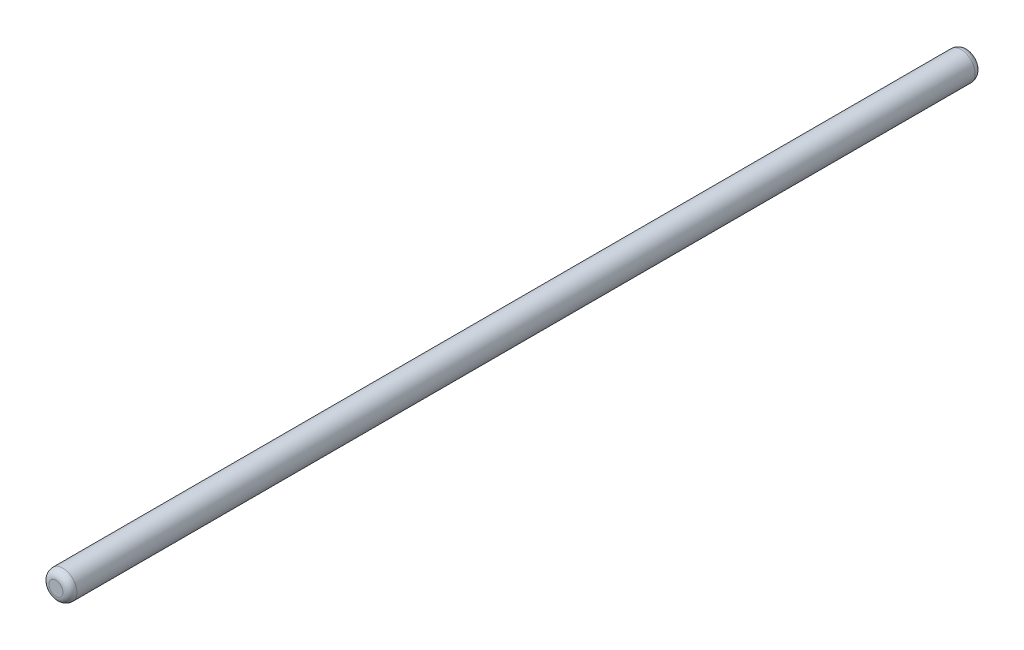
from build123d import *

# Parameters (mm, degrees)
SKETCH1_R           = 4
BOSS_EXTRUDE1_DEPTH = 260.525021331
FILLET1_R           = 2


with BuildPart() as part:
    # Sketch1 → Boss-Extrude1 (new body)
    with BuildSketch(Plane.XY):
        Circle(SKETCH1_R)
    extrude(amount=BOSS_EXTRUDE1_DEPTH)

    # Fillet1
    fillet1_edges = [part.edges().sort_by_distance(p)[0] for p in [
        (-4, 0, 0),
        (-4, 0, 260.525021331),
    ]]
    fillet(fillet1_edges, radius=FILLET1_R)


solid = part.part
